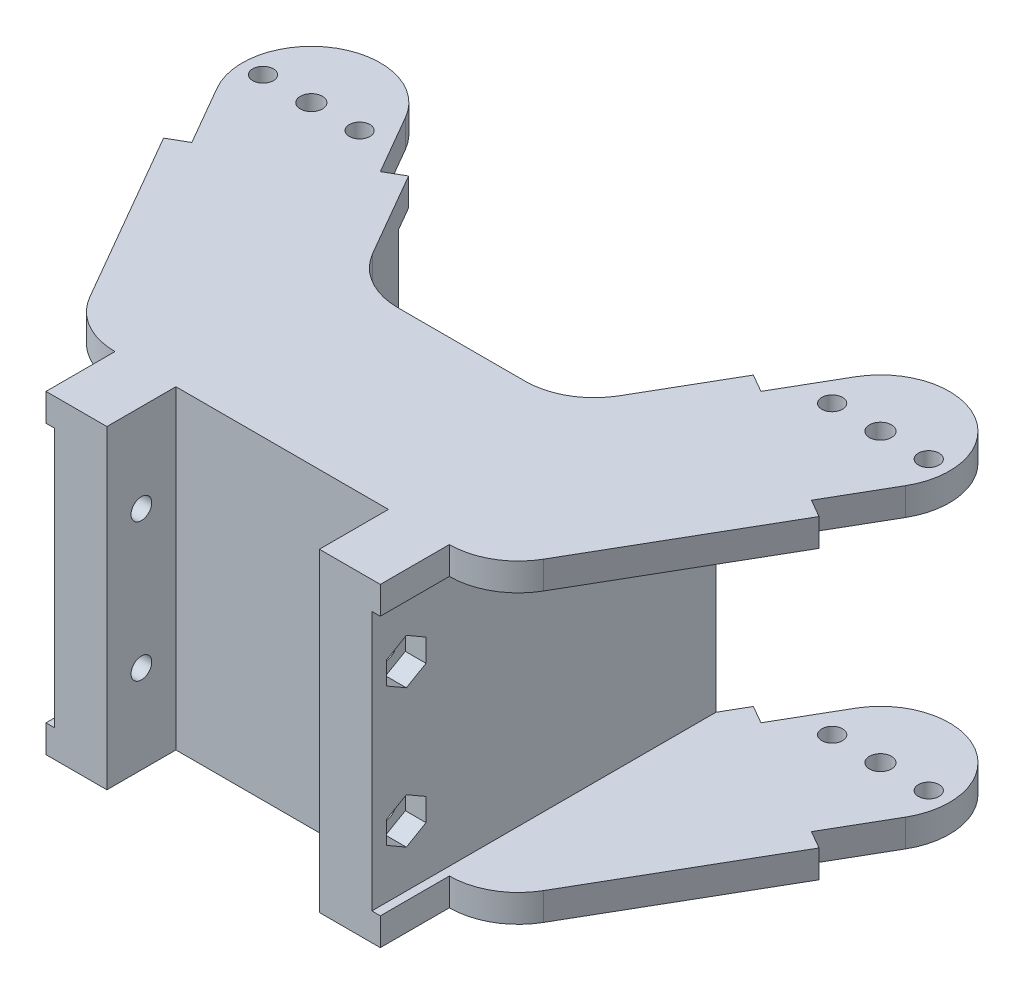
from build123d import *

# Parameters (mm, degrees)
SALIENTE_EXTRUIR1_DEPTH                = 45.6
CORTAR_EXTRUIR1_START                  = -37.6
CORTAR_EXTRUIR1_DEPTH                  = 37.6
CORTAR_EXTRUIR2_DEPTH                  = 37.6
SALIENTE_EXTRUIR2_DEPTH                = 10
CROQUIS5_W                             = 30.8
CROQUIS5_H                             = 10
CORTAR_EXTRUIR3_DEPTH                  = 118.087897795
CORTAR_EXTRUIR4_DEPTH                  = 3
CORTAR_EXTRUIR5_DEPTH                  = 3
CROQUIS8_W                             = 1.5
CROQUIS8_H                             = 35.841669751
DI_METRO_DE_TALADRO_3_0_3_1_AT_2_COUNT = 2
DI_METRO_DE_TALADRO_3_0_3_1_AT_2_PITCH = 20
DI_METRO_DE_TALADRO_3_0_3_2_D          = 3
DI_METRO_DE_TALADRO_3_0_3_2_DEPTH      = 4
DI_METRO_DE_TALADRO_3_2_3_2_1_D        = 3.2
DI_METRO_DE_TALADRO_3_2_3_2_1_DEPTH    = 4
DI_METRO_DE_TALADRO_3_0_3_3_D          = 3
DI_METRO_DE_TALADRO_3_0_3_3_DEPTH      = 4
DI_METRO_DE_TALADRO_3_0_3_4_D          = 3
DI_METRO_DE_TALADRO_3_0_3_5_D          = 3
DI_METRO_DE_TALADRO_3_0_3_5_DEPTH      = 45.6
DI_METRO_DE_TALADRO_3_2_3_2_2_D        = 3.2
DI_METRO_DE_TALADRO_3_2_3_2_2_DEPTH    = 4
DI_METRO_DE_TALADRO_3_2_3_2_3_D        = 3.2
DI_METRO_DE_TALADRO_3_2_3_2_4_D        = 3.2
DI_METRO_DE_TALADRO_3_2_3_2_4_DEPTH    = 45.6
DI_METRO_DE_TALADRO_3_0_3_6_D          = 3
DI_METRO_DE_TALADRO_3_0_3_6_DEPTH      = 71.241669751
REDONDEO1_R                            = 10


with BuildPart() as part:
    # Croquis1 → Saliente-Extruir1 (new body)
    with BuildSketch(Plane.XZ.offset(45.6)):
        with BuildLine():
            Line((65.468167059, 45.47114317), (17.015172443, 45.47114317))
            ThreePointArc((17.015172443, 45.47114317), (12.015172443, 44.131397208), (8.354918405, 40.47114317))
            Line((8.354918405, 40.47114317), (-6.258330249, 15.160254038))
            Line((-6.258330249, 15.160254038), (-3.660254038, 13.660254038))
            Line((-3.660254038, 13.660254038), (-8.660254038, 5))
            ThreePointArc((-8.660254038, 5), (-5, -8.660254038), (8.660254038, -5))
            Line((8.660254038, -5), (13.660254038, 3.660254038))
            Line((13.660254038, 3.660254038), (16.258330249, 2.160254038))
            Line((16.258330249, 2.160254038), (26.25277675, 19.47114317))
            Line((26.25277675, 19.47114317), (56.230562752, 19.47114317))
            Line((56.230562752, 19.47114317), (66.225009252, 2.160254038))
            Line((66.225009252, 2.160254038), (68.823085464, 3.660254038))
            Line((68.823085464, 3.660254038), (73.823085464, -5))
            ThreePointArc((73.823085464, -5), (87.483339502, -8.660254038), (91.143593539, 5))
            Line((91.143593539, 5), (86.143593539, 13.660254038))
            Line((86.143593539, 13.660254038), (88.741669751, 15.160254038))
            Line((88.741669751, 15.160254038), (74.128421097, 40.47114317))
            ThreePointArc((74.128421097, 40.47114317), (70.468167059, 44.131397208), (65.468167059, 45.47114317))
        make_face()
    extrude(amount=-SALIENTE_EXTRUIR1_DEPTH)

    # Croquis2 → Cortar-Extruir1 (cut)
    with BuildSketch(Plane(origin=(0, -4, 0), x_dir=(1, 0, 0), z_dir=(0, 1, 0)).offset(CORTAR_EXTRUIR1_START)):
        with BuildLine():
            Line((64.241669751, -45.47114317), (65.468167059, -45.47114317))
            ThreePointArc((65.468167059, -45.47114317), (70.468167059, -44.131397208), (74.128421097, -40.47114317))
            Line((74.128421097, -40.47114317), (88.741669751, -15.160254038))
            Line((88.741669751, -15.160254038), (86.143593539, -13.660254038))
            Line((86.143593539, -13.660254038), (91.143593539, -5))
            ThreePointArc((91.143593539, -5), (87.483339502, 8.660254038), (73.823085464, 5))
            Line((73.823085464, 5), (68.823085464, -3.660254038))
            Line((68.823085464, -3.660254038), (66.225009252, -2.160254038))
            Line((66.225009252, -2.160254038), (64.241669751, -5.595498823))
            Line((64.241669751, -5.595498823), (64.241669751, -45.47114317))
        make_face()
    extrude(amount=CORTAR_EXTRUIR1_DEPTH, mode=Mode.SUBTRACT)

    # Croquis3 → Cortar-Extruir2 (cut)
    with BuildSketch(Plane.XZ.offset(41.6)):
        with BuildLine():
            Line((18.241669751, 5.595498823), (18.241669751, 45.47114317))
            Line((18.241669751, 45.47114317), (17.015172443, 45.47114317))
            ThreePointArc((17.015172443, 45.47114317), (12.015172443, 44.131397208), (8.354918405, 40.47114317))
            Line((8.354918405, 40.47114317), (-6.258330249, 15.160254038))
            Line((-6.258330249, 15.160254038), (-3.660254038, 13.660254038))
            Line((-3.660254038, 13.660254038), (-8.660254038, 5))
            ThreePointArc((-8.660254038, 5), (-5, -8.660254038), (8.660254038, -5))
            Line((8.660254038, -5), (13.660254038, 3.660254038))
            Line((13.660254038, 3.660254038), (16.258330249, 2.160254038))
            Line((16.258330249, 2.160254038), (18.241669751, 5.595498823))
        make_face()
    extrude(amount=-CORTAR_EXTRUIR2_DEPTH, mode=Mode.SUBTRACT)

    # Croquis4 → Saliente-Extruir2 (add)
    with BuildSketch(Plane.XY.offset(45.47114317)):
        Polygon((65.468167059, -45.6), (17.015172443, -45.6), (17.015172443, -41.6), (18.241669751, -41.6), (18.241669751, -4), (17.015172443, -4), (17.015172443, 0), (65.468167059, 0), (65.468167059, -4), (64.241669751, -4), (64.241669751, -41.6), (65.468167059, -41.6), align=None)
    extrude(amount=SALIENTE_EXTRUIR2_DEPTH)

    # Croquis5 → Cortar-Extruir3 (cut, through all)
    with BuildSketch(Plane(origin=(0, 0, 0), x_dir=(-1, 0, 0), z_dir=(0, 1, 0))):
        with Locations((-41.241669751, 50.47114317)):
            Rectangle(CROQUIS5_W, CROQUIS5_H)
    extrude(amount=-CORTAR_EXTRUIR3_DEPTH, mode=Mode.SUBTRACT)

    # Croquis6 → Cortar-Extruir4 (cut)
    with BuildSketch(Plane(origin=(64.241669751, 0, 0), x_dir=(0, 0, -1), z_dir=(1, 0, 0))):
        Polygon((-47.620680834, -34.444647218), (-47.621605732, -31.153750813), (-50.472068068, -29.509103596), (-53.321605506, -31.155352782), (-53.320680609, -34.446249187), (-50.470218273, -36.090896404), align=None)
    extrude(amount=-CORTAR_EXTRUIR4_DEPTH, mode=Mode.SUBTRACT)

    # Croquis7 → Cortar-Extruir5 (cut)
    with BuildSketch(Plane(origin=(64.241669751, 0, 0), x_dir=(0, 0, -1), z_dir=(1, 0, 0))):
        Polygon((-50.470218273, -9.509103596), (-53.320680609, -11.153750813), (-53.321605506, -14.444647218), (-50.472068068, -16.090896404), (-47.621605732, -14.446249187), (-47.620680834, -11.155352782), align=None)
    extrude(amount=-CORTAR_EXTRUIR5_DEPTH, mode=Mode.SUBTRACT)

    # Croquis8 → Diámetro de taladro Ø3.0 (3)1 (revolve, cut)
    with BuildSketch(Plane(origin=(25.841669751, -12.8, 50.47114317), x_dir=(0, 0, -1), z_dir=(0, 1, 0))):
        with Locations((0.75, 17.920834876)):
            Rectangle(CROQUIS8_W, CROQUIS8_H)
    di_metro_de_taladro_3_0_3_1 = revolve(axis=Axis((32.191669751, -12.8, 50.47114317), (-1, 0, 0)), mode=Mode.SUBTRACT)

    # Diámetro de taladro Ø3.0 (3)1 at 2: Diámetro de taladro Ø3.0 (3)1 ×2
    with Locations(*[(0, -i * DI_METRO_DE_TALADRO_3_0_3_1_AT_2_PITCH, 0) for i in range(1, DI_METRO_DE_TALADRO_3_0_3_1_AT_2_COUNT)]):
        add(di_metro_de_taladro_3_0_3_1, mode=Mode.SUBTRACT)

    # Diámetro de taladro Ø3.0 (3)2
    with Locations(Plane(origin=(0, -45.6, 0), x_dir=(-1, 0, 0), z_dir=(0, -1, 0))):
        with Locations((-89.483339502, 0), (-75.483339502, 0)):
            Hole(DI_METRO_DE_TALADRO_3_0_3_2_D / 2, depth=DI_METRO_DE_TALADRO_3_0_3_2_DEPTH)

    # Diámetro de taladro Ø3.2 (3.2)1
    with Locations(Plane(origin=(0, -45.6, 0), x_dir=(-1, 0, 0), z_dir=(0, -1, 0))):
        with Locations((-82.483339502, 0)):
            Hole(DI_METRO_DE_TALADRO_3_2_3_2_1_D / 2, depth=DI_METRO_DE_TALADRO_3_2_3_2_1_DEPTH)

    # Diámetro de taladro Ø3.0 (3)3
    with Locations(Plane(origin=(0, -4, 0), x_dir=(-1, 0, 0), z_dir=(0, -1, 0))):
        with Locations((-7, 0), (7, 0)):
            Hole(DI_METRO_DE_TALADRO_3_0_3_3_D / 2, depth=DI_METRO_DE_TALADRO_3_0_3_3_DEPTH)

    # Diámetro de taladro Ø3.0 (3)4 (through all)
    with Locations(Plane(origin=(0, -41.6, 0), x_dir=(1, 0, 0), z_dir=(0, 1, 0))):
        with Locations((7, 0), (-7, 0)):
            Hole(DI_METRO_DE_TALADRO_3_0_3_4_D / 2)

    # Diámetro de taladro Ø3.0 (3)5
    with Locations(Plane(origin=(0, 0, 0), x_dir=(1, 0, 0), z_dir=(0, 1, 0))):
        with Locations((89.483339502, 0), (75.483339502, 0)):
            Hole(DI_METRO_DE_TALADRO_3_0_3_5_D / 2, depth=DI_METRO_DE_TALADRO_3_0_3_5_DEPTH)

    # Diámetro de taladro Ø3.2 (3.2)2
    with Locations(Plane(origin=(0, -4, 0), x_dir=(-1, 0, 0), z_dir=(0, -1, 0))):
        with Locations((0, 0)):
            Hole(DI_METRO_DE_TALADRO_3_2_3_2_2_D / 2, depth=DI_METRO_DE_TALADRO_3_2_3_2_2_DEPTH)

    # Diámetro de taladro Ø3.2 (3.2)3 (through all)
    with Locations(Plane(origin=(0, -41.6, 0), x_dir=(1, 0, 0), z_dir=(0, 1, 0))):
        with Locations((0, 0)):
            Hole(DI_METRO_DE_TALADRO_3_2_3_2_3_D / 2)

    # Diámetro de taladro Ø3.2 (3.2)4
    with Locations(Plane(origin=(0, 0, 0), x_dir=(1, 0, 0), z_dir=(0, 1, 0))):
        with Locations((82.483339502, 0)):
            Hole(DI_METRO_DE_TALADRO_3_2_3_2_4_D / 2, depth=DI_METRO_DE_TALADRO_3_2_3_2_4_DEPTH)

    # Diámetro de taladro Ø3.0 (3)6
    with Locations(Plane(origin=(61.241669751, 0, 0), x_dir=(0, 0, -1), z_dir=(1, 0, 0))):
        with Locations((-50.47114317, -12.8), (-50.47114317, -32.8)):
            Hole(DI_METRO_DE_TALADRO_3_0_3_6_D / 2, depth=DI_METRO_DE_TALADRO_3_0_3_6_DEPTH)

    # Redondeo1
    redondeo1_edges = [part.edges().sort_by_distance(p)[0] for p in [
        (56.230562752, -22.8, 19.47114317),
        (26.25277675, -22.8, 19.47114317),
    ]]
    fillet(redondeo1_edges, radius=REDONDEO1_R)


solid = part.part
